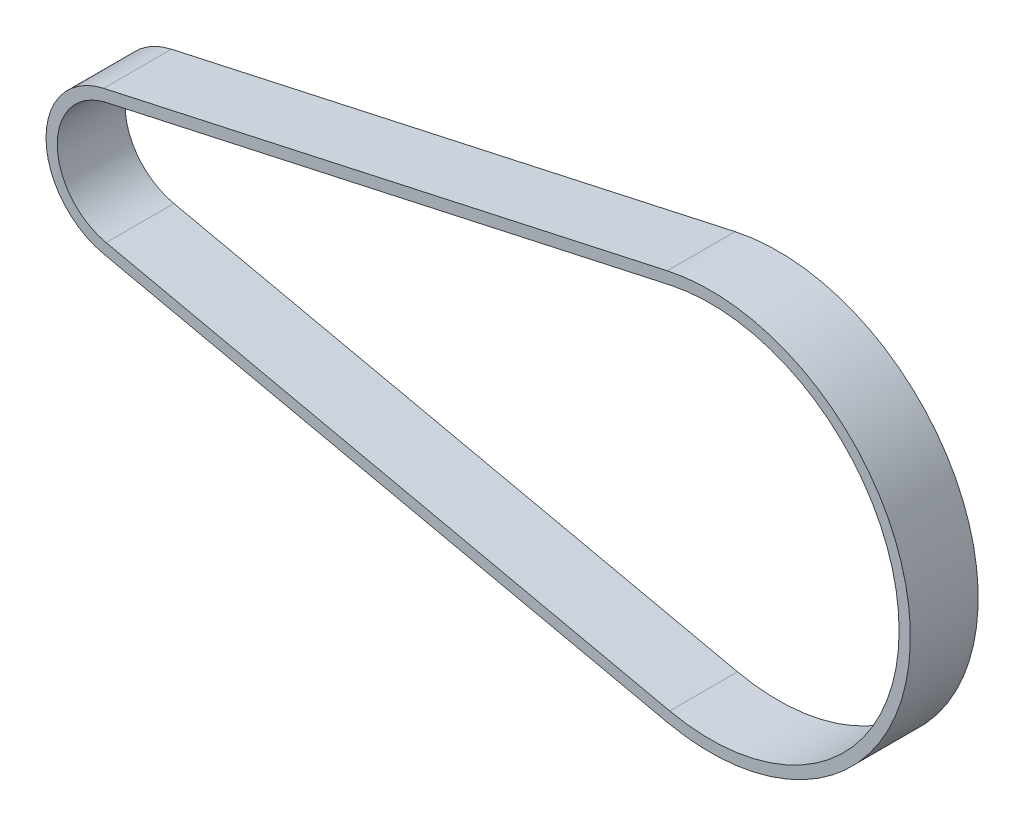
from build123d import *

# Parameters (mm, degrees)
SALIENTE_EXTRUIR1_DEPTH = 6


with BuildPart() as part:
    # Croquis1 → Saliente-Extruir1 (new body)
    with BuildSketch(Plane.XY):
        with BuildLine():
            Line((-1.394455067, 6.348660888), (48.498500956, 17.307426297))
            ThreePointArc((48.498500956, 17.307426297), (70.02, 0), (48.498500956, -17.307426297))
            Line((48.498500956, -17.307426297), (-1.394455067, -6.348660888))
            ThreePointArc((-1.394455067, -6.348660888), (-6.5, 0), (-1.394455067, 6.348660888))
        make_face()
        with BuildLine():
            Line((-1.179923518, 5.371943828), (48.713032505, 16.330709237))
            ThreePointArc((48.713032505, 16.330709237), (69.02, 0), (48.713032505, -16.330709237))
            Line((48.713032505, -16.330709237), (-1.179923518, -5.371943828))
            ThreePointArc((-1.179923518, -5.371943828), (-5.5, 0), (-1.179923518, 5.371943828))
        make_face(mode=Mode.SUBTRACT)
    extrude(amount=SALIENTE_EXTRUIR1_DEPTH)


solid = part.part
